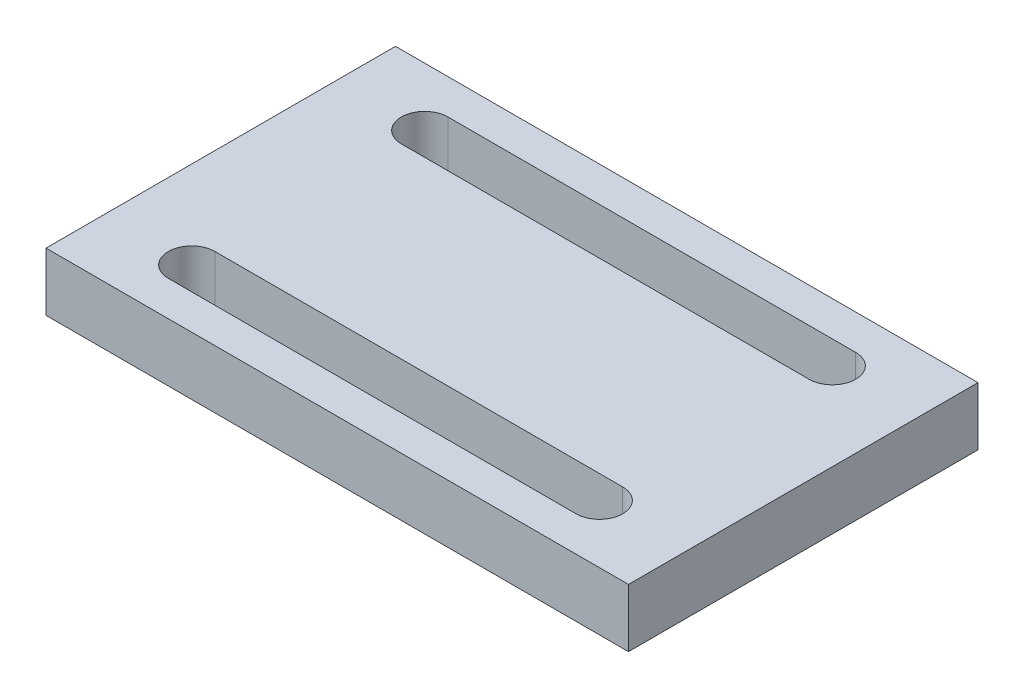
from build123d import *

# Parameters (mm, degrees)
SKETCH1_W           = 50
SKETCH1_H           = 30
BOSS_EXTRUDE1_DEPTH = 5


with BuildPart() as part:
    # Sketch1 → Boss-Extrude1 (new body)
    with BuildSketch(Plane(origin=(0, 0, 0), x_dir=(1, 0, 0), z_dir=(0, 1, 0))):
        with Locations((25, 15)):
            Rectangle(SKETCH1_W, SKETCH1_H)
        with BuildLine():
            Line((7.5, 27), (42.5, 27))
            ThreePointArc((42.5, 27), (44.5, 25), (42.5, 23))
            Line((42.5, 23), (7.5, 23))
            ThreePointArc((7.5, 23), (5.5, 25), (7.5, 27))
        make_face(mode=Mode.SUBTRACT)
        with BuildLine():
            Line((42.5, 7), (7.5, 7))
            ThreePointArc((7.5, 7), (5.5, 5), (7.5, 3))
            Line((7.5, 3), (42.5, 3))
            ThreePointArc((42.5, 3), (44.5, 5), (42.5, 7))
        make_face(mode=Mode.SUBTRACT)
    extrude(amount=BOSS_EXTRUDE1_DEPTH)


solid = part.part
